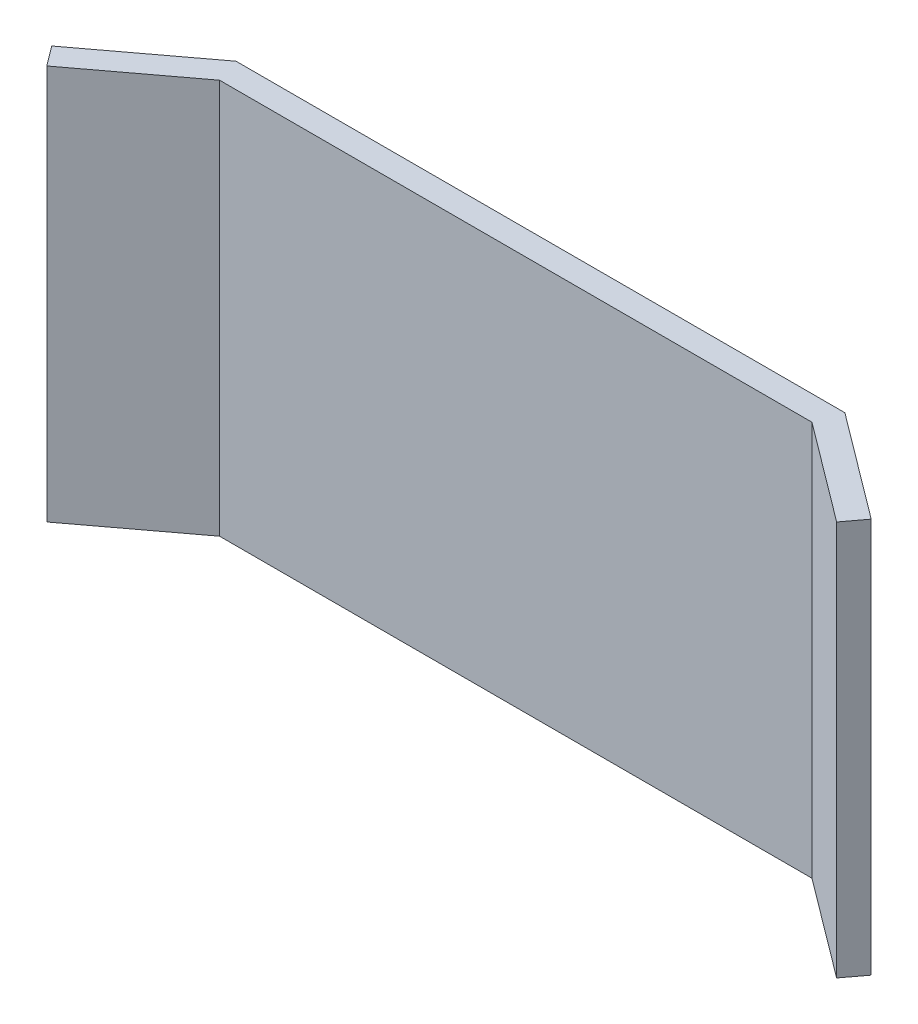
from build123d import *

# Parameters (mm, degrees)
BOSS_EXTRUDE1_DEPTH = 80
SKETCH2_W           = 80
SKETCH2_H           = 10
BOSS_EXTRUDE2_DEPTH = 25


with BuildPart() as part:
    # Sketch1 → Boss-Extrude1 (new body)
    with BuildSketch(Plane(origin=(0, 0, 0), x_dir=(1, 0, 0), z_dir=(0, 1, 0))):
        Polygon((-60, 0), (60, 0), (80, -15), (83, -11), (61.666666667, 5), (-61.666666667, 5), (-83, -11), (-80, -15), align=None)
    extrude(amount=-BOSS_EXTRUDE1_DEPTH)

    # Sketch2 → Boss-Extrude2 (add)
    with BuildSketch(Plane(origin=(0, 0, -5), x_dir=(-1, 0, 0), z_dir=(0, 0, -1))):
        with Locations((0, -60)):
            Rectangle(SKETCH2_W, SKETCH2_H)
    extrude(amount=BOSS_EXTRUDE2_DEPTH)


solid = part.part
